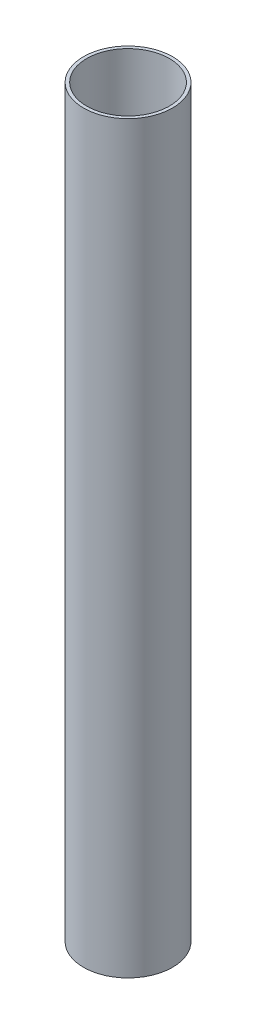
from build123d import *

# Parameters (mm, degrees)
SKETCH_1_R      = 20.1
SKETCH_1_R_2    = 18.65
EXTRUDE_1_DEPTH = 336


with BuildPart() as part:
    # 草图1 → 凸台-拉伸1 (new body)
    with BuildSketch(Plane(origin=(0, 0, 0), x_dir=(1, 0, 0), z_dir=(0, 1, 0))):
        Circle(SKETCH_1_R)
        Circle(SKETCH_1_R_2, mode=Mode.SUBTRACT)
    extrude(amount=EXTRUDE_1_DEPTH)


solid = part.part
